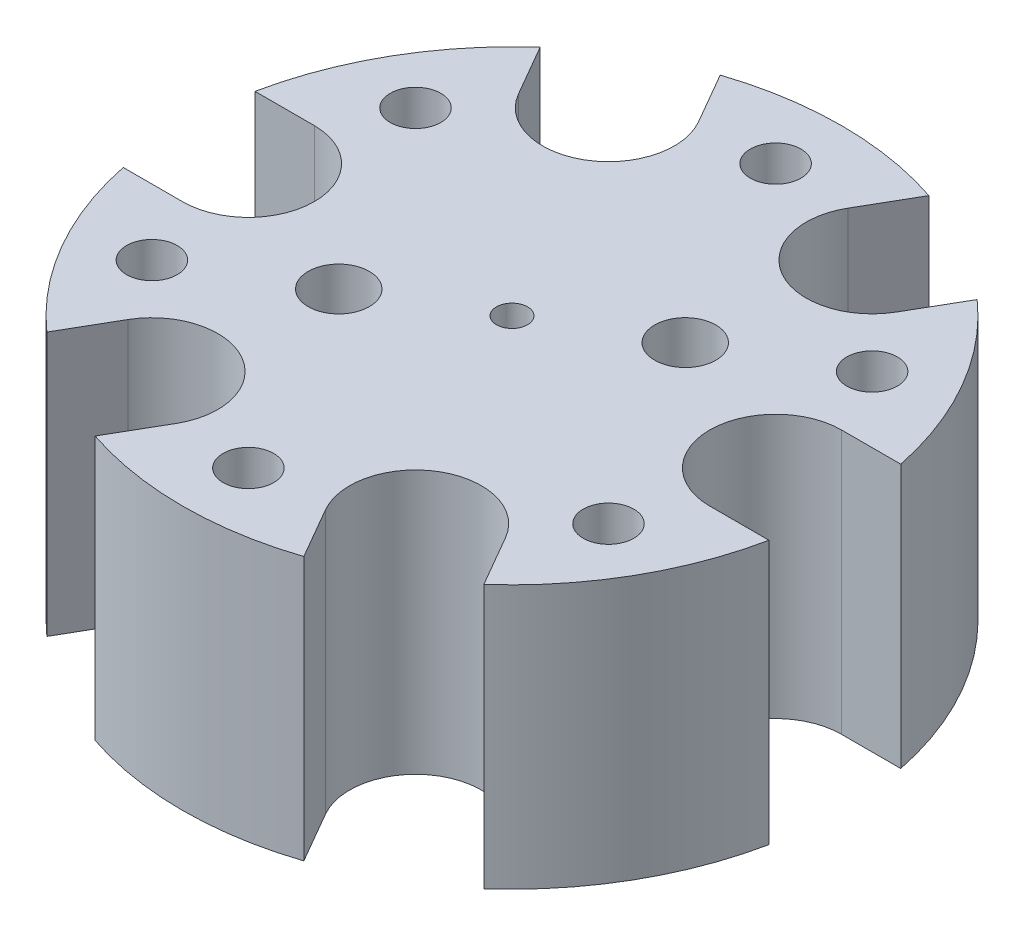
from build123d import *

# Parameters (mm, degrees)
SKETCH1_R                   = 15.875
BOSS_EXTRUDE1_DEPTH         = 12.7
SKETCH2_R                   = 0.7493
CUT_EXTRUDE1_DEPTH          = 20
SKETCH3_R                   = 1.2192
CUT_EXTRUDE3_DEPTH          = 26.793821935
CUT_EXTRUDE4_START          = -20
CUT_EXTRUDE4_DEPTH          = 20
CIRPATTERN1_COUNT           = 6
F_32_0_116_DIAMETER_HOLE2_D = 2.9464


with BuildPart() as part:
    # Sketch1 → Boss-Extrude1 (new body)
    with BuildSketch(Plane(origin=(0, 0, 0), x_dir=(1, 0, 0), z_dir=(0, 1, 0))):
        with Locations(Location((0, 0, 0), (0, 0, 270))):
            Circle(SKETCH1_R)
    extrude(amount=BOSS_EXTRUDE1_DEPTH)

    # Sketch2 → Cut-Extrude1 (cut)
    with BuildSketch(Plane(origin=(0, 12.7, 0), x_dir=(1, 0, 0), z_dir=(0, 1, 0))):
        with Locations(Location((0, 0, 0), (0, 0, 270))):
            Circle(SKETCH2_R)
    extrude(amount=-CUT_EXTRUDE1_DEPTH, mode=Mode.SUBTRACT)

    # Sketch3 → Cut-Extrude3 (cut, through all)
    with BuildSketch(Plane(origin=(0, 12.7, 0), x_dir=(1, 0, 0), z_dir=(0, 1, 0))):
        with Locations(Location((0, 12.7, 0), (0, 0, 270))):
            Circle(SKETCH3_R)
    cut_extrude3 = extrude(amount=-CUT_EXTRUDE3_DEPTH, mode=Mode.SUBTRACT)

    # Sketch4 → Cut-Extrude4 (cut)
    with BuildSketch(Plane(origin=(0, 12.7, 0), x_dir=(1, 0, 0), z_dir=(0, 1, 0)).offset(CUT_EXTRUDE4_START)):
        with BuildLine():
            ThreePointArc((12.7, 3.175), (9.525, 0), (12.7, -3.175))
            Line((12.7, -3.175), (12.7, 3.175))
        make_face()
        with BuildLine():
            Line((12.7, 3.175), (12.7, -3.175))
            ThreePointArc((12.7, -3.175), (14.94506403, -2.24506403), (15.875, 0))
            ThreePointArc((15.875, 0), (14.94506403, 2.24506403), (12.7, 3.175))
        make_face()
        with BuildLine():
            ThreePointArc((15.875, 0), (15.794611429, -1.595579772), (15.554259867, -3.175))
            Line((15.554259867, -3.175), (20.958617126, -3.175))
            Line((20.958617126, -3.175), (20.958617126, 3.175))
            Line((20.958617126, 3.175), (15.554259867, 3.175))
            ThreePointArc((15.554259867, 3.175), (15.794611429, 1.595579772), (15.875, 0))
        make_face()
        with BuildLine():
            Line((15.554259867, 3.175), (12.7, 3.175))
            ThreePointArc((12.7, 3.175), (14.94506403, 2.24506403), (15.875, 0))
            ThreePointArc((15.875, 0), (15.794611429, 1.595579772), (15.554259867, 3.175))
        make_face()
        with BuildLine():
            ThreePointArc((15.875, 0), (14.94506403, -2.24506403), (12.7, -3.175))
            Line((12.7, -3.175), (15.554259867, -3.175))
            ThreePointArc((15.554259867, -3.175), (15.794611429, -1.595579772), (15.875, 0))
        make_face()
    cut_extrude4 = extrude(amount=CUT_EXTRUDE4_DEPTH, mode=Mode.SUBTRACT)

    # CirPattern1: Cut-Extrude3, Cut-Extrude4 ×6 about axis
    cirpattern1_axis = Axis((0, 0, 0), (0, 1, 0))
    add([cut_extrude3.rotate(cirpattern1_axis, i * 360 / CIRPATTERN1_COUNT) for i in range(1, CIRPATTERN1_COUNT)], mode=Mode.SUBTRACT)
    add([cut_extrude4.rotate(cirpattern1_axis, i * 360 / CIRPATTERN1_COUNT) for i in range(1, CIRPATTERN1_COUNT)], mode=Mode.SUBTRACT)

    # #32 (0.116) Diameter Hole2 (through all)
    with Locations(Plane(origin=(0, 0, 0), x_dir=(-1, 0, 0), z_dir=(0, -1, 0))):
        with Locations((5.291415217, -3.055), (-5.291415217, 3.055)):
            Hole(F_32_0_116_DIAMETER_HOLE2_D / 2)


solid = part.part
